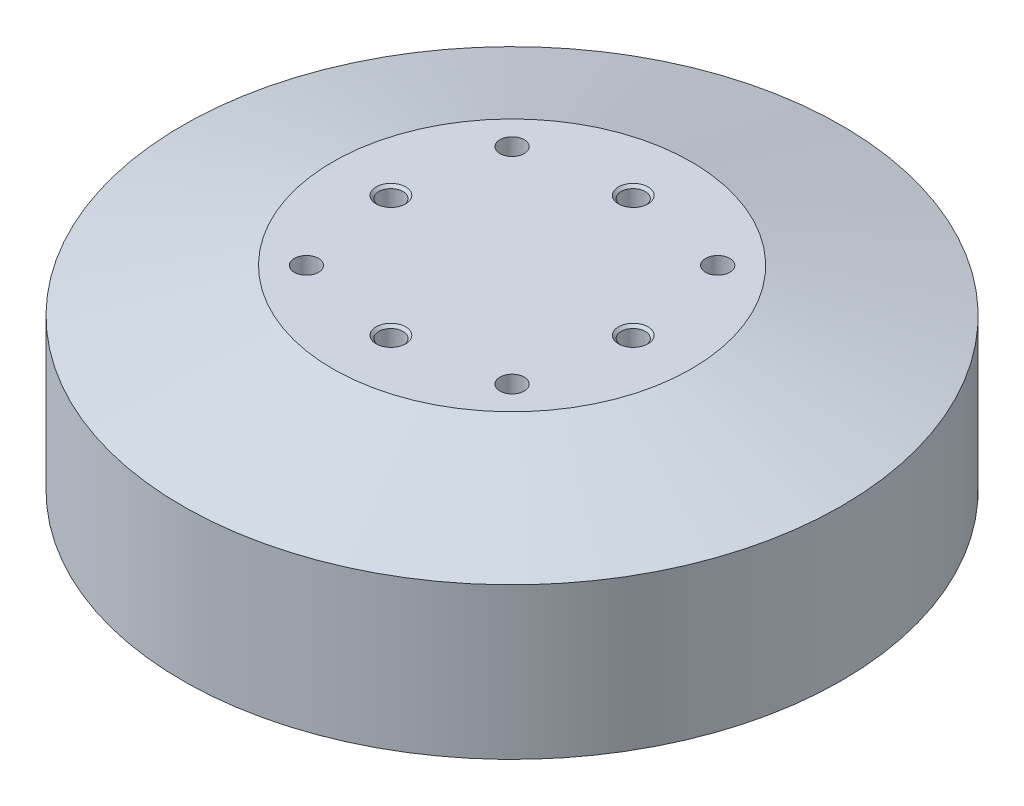
from build123d import *

# Parameters (mm, degrees)
SKETCH4_R                       = 33
CUT_EXTRUDE1_DEPTH              = 2
M3X0_5_TAPPED_HOLE1_D           = 2.5
M3X0_5_TAPPED_HOLE1_DEPTH       = 7.5
M3X0_5_TAPPED_HOLE1_TIP         = 0.751075774
M3X0_5_TAPPED_HOLE2_D           = 2.5
M3X0_5_TAPPED_HOLE2_DEPTH       = 7.5
M3X0_5_TAPPED_HOLE2_CSINK_D     = 3.05
M3X0_5_TAPPED_HOLE2_CSINK_ANGLE = 90
M3X0_5_TAPPED_HOLE2_TIP         = 0.751075774


with BuildPart() as part:
    # Sketch3 → Revolve1 (revolve)
    with BuildSketch(Plane.XY):
        Polygon((0, -10.05), (0, 10.05), (18.5, 10.05), (34, 5.55), (34, -10.05), align=None)
    revolve(axis=Axis((0, -10.05, 0), (0, 1, 0)))

    # Sketch4 → Cut-Extrude1 (cut)
    with BuildSketch(Plane.XZ.offset(10.05)):
        Circle(SKETCH4_R)
    extrude(amount=-CUT_EXTRUDE1_DEPTH, mode=Mode.SUBTRACT)

    # M3x0.5 Tapped Hole1
    with Locations(Plane(origin=(0, 10.05, 0), x_dir=(1, 0, 0), z_dir=(0, 1, 0))):
        with Locations((-10.606601718, 10.606601718), (10.606601718, 10.606601718), (10.606601718, -10.606601718), (-10.606601718, -10.606601718)):
            Hole(M3X0_5_TAPPED_HOLE1_D / 2, depth=M3X0_5_TAPPED_HOLE1_DEPTH)
            with Locations((0, 0, -(M3X0_5_TAPPED_HOLE1_DEPTH + M3X0_5_TAPPED_HOLE1_TIP / 2))):  # 118° drill point
                Cone(0, M3X0_5_TAPPED_HOLE1_D / 2, M3X0_5_TAPPED_HOLE1_TIP, mode=Mode.SUBTRACT)

    # M3x0.5 Tapped Hole2
    with Locations(Plane(origin=(0, 10.05, 0), x_dir=(1, 0, 0), z_dir=(0, 1, 0))):
        with Locations((0, 12.5), (0, -12.5), (-12.5, 0), (12.5, 0)):
            CounterSinkHole(M3X0_5_TAPPED_HOLE2_D / 2, M3X0_5_TAPPED_HOLE2_CSINK_D / 2, depth=M3X0_5_TAPPED_HOLE2_DEPTH, counter_sink_angle=M3X0_5_TAPPED_HOLE2_CSINK_ANGLE)
            with Locations((0, 0, -(M3X0_5_TAPPED_HOLE2_DEPTH + M3X0_5_TAPPED_HOLE2_TIP / 2))):  # 118° drill point
                Cone(0, M3X0_5_TAPPED_HOLE2_D / 2, M3X0_5_TAPPED_HOLE2_TIP, mode=Mode.SUBTRACT)


solid = part.part
